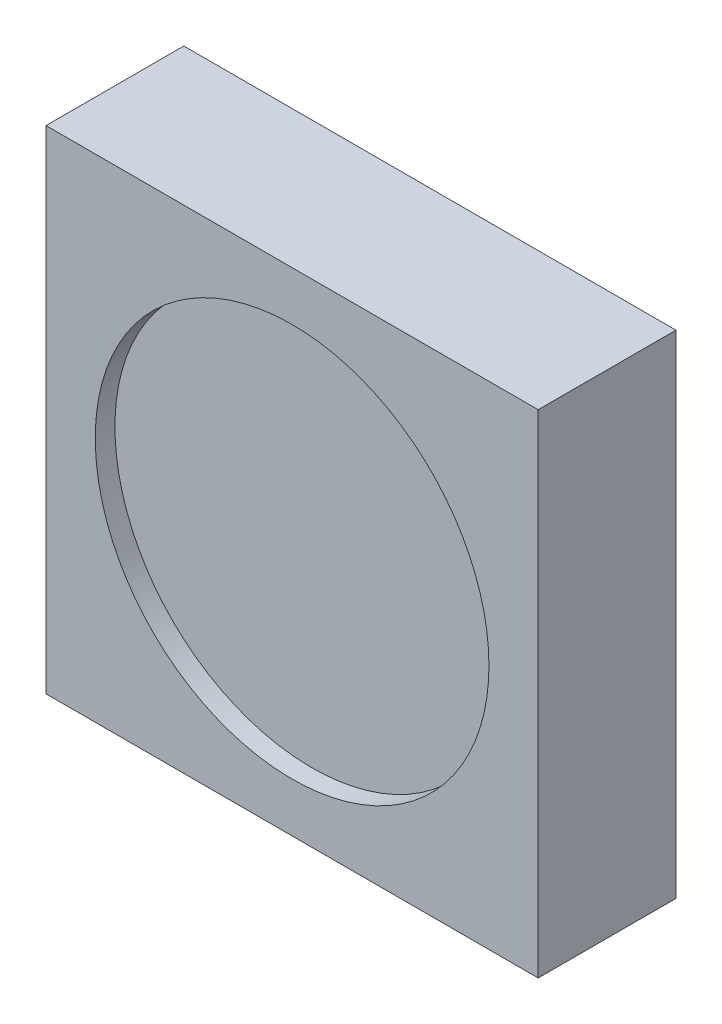
from build123d import *

# Parameters (mm, degrees)
SKETCH1_W           = 5
SKETCH1_H           = 5
BOSS_EXTRUDE1_DEPTH = 1.4
SKETCH2_R           = 2
CUT_EXTRUDE1_DEPTH  = 0.2


with BuildPart() as part:
    # Sketch1 → Boss-Extrude1 (new body)
    with BuildSketch(Plane.XY):
        Rectangle(SKETCH1_W, SKETCH1_H)
    extrude(amount=BOSS_EXTRUDE1_DEPTH)

    # Sketch2 → Cut-Extrude1 (cut)
    with BuildSketch(Plane.XY.offset(1.4)):
        Circle(SKETCH2_R)
    extrude(amount=-CUT_EXTRUDE1_DEPTH, mode=Mode.SUBTRACT)


solid = part.part
